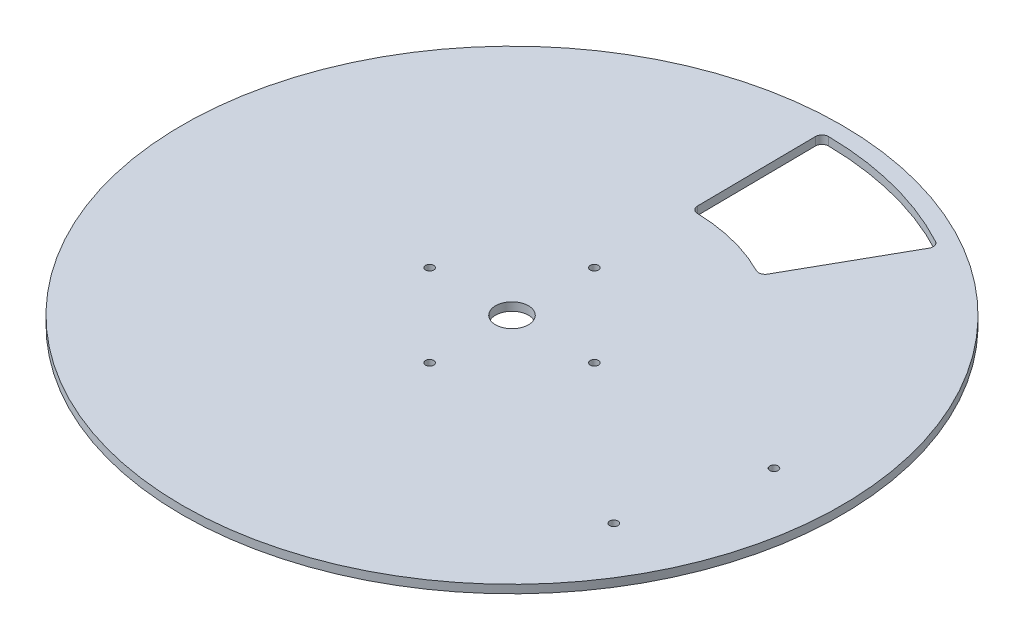
from build123d import *

# Parameters (mm, degrees)
SKETCH1_R           = 127
BOSS_EXTRUDE1_DEPTH = 3.175
SKETCH2_R           = 6.35
CUT_EXTRUDE1_DEPTH  = 180.63318353
CUT_EXTRUDE2_DEPTH  = 180.63318353
SKETCH4_R           = 1.5875
CUT_EXTRUDE3_DEPTH  = 180.63318353
CIRPATTERN1_COUNT   = 4
FILLET1_R           = 2.54
SKETCH5_R           = 1.5875
CUT_EXTRUDE4_DEPTH  = 180.63318353


with BuildPart() as part:
    # Sketch1 → Boss-Extrude1 (new body)
    with BuildSketch(Plane(origin=(0, 0, 0), x_dir=(1, 0, 0), z_dir=(0, 1, 0))):
        with Locations(Location((0, 0, 0), (0, 0, 270))):
            Circle(SKETCH1_R)
    extrude(amount=BOSS_EXTRUDE1_DEPTH)

    # Sketch2 → Cut-Extrude1 (cut, through all)
    with BuildSketch(Plane(origin=(0, 3.175, 0), x_dir=(1, 0, 0), z_dir=(0, 1, 0))):
        with Locations(Location((0, 0, 0), (0, 0, 270))):
            Circle(SKETCH2_R)
    extrude(amount=-CUT_EXTRUDE1_DEPTH, mode=Mode.SUBTRACT)

    # Sketch3 → Cut-Extrude2 (cut, through all)
    with BuildSketch(Plane(origin=(0, 3.175, 0), x_dir=(1, 0, 0), z_dir=(0, 1, 0))):
        with BuildLine():
            Line((-0.69608151, 69.707591228), (-1.204718825, 120.643985149))
            ThreePointArc((-1.204718825, 120.643985149), (30.046443244, 116.817986877), (59.221085226, 104.981025331))
            Line((59.221085226, 104.981025331), (34.319233166, 60.837593106))
            ThreePointArc((34.319233166, 60.837593106), (17.387075213, 67.544440681), (-0.69608151, 69.707591228))
        make_face()
    extrude(amount=-CUT_EXTRUDE2_DEPTH, mode=Mode.SUBTRACT)

    # Sketch4 → Cut-Extrude3 (cut, through all)
    with BuildSketch(Plane(origin=(0, 3.175, 0), x_dir=(1, 0, 0), z_dir=(0, 1, 0))):
        with Locations(Location((0, -31.75, 0), (0, 0, 270))):
            Circle(SKETCH4_R)
    cut_extrude3 = extrude(amount=-CUT_EXTRUDE3_DEPTH, mode=Mode.SUBTRACT)

    # CirPattern1: Cut-Extrude3 ×4 about axis
    cirpattern1_axis = Axis((0, 0, 0), (0, 1, 0))
    for i in range(1, CIRPATTERN1_COUNT):
        add(cut_extrude3.rotate(cirpattern1_axis, i * 360 / CIRPATTERN1_COUNT), mode=Mode.SUBTRACT)

    # Fillet1
    fillet1_edges = [part.edges().sort_by_distance(p)[0] for p in [
        (34.319233166, 1.5875, -60.837593106),
        (-0.69608151, 1.5875, -69.707591228),
        (-1.204718825, 1.5875, -120.643985149),
        (59.221085226, 1.5875, -104.981025331),
    ]]
    fillet(fillet1_edges, radius=FILLET1_R)

    # Sketch5 → Cut-Extrude4 (cut, through all)
    with BuildSketch(Plane.XZ):
        with Locations(Location((89.061954982, 49.824926956, 0), (0, 0, 270))):
            Circle(SKETCH5_R)
        with Locations(Location((101.542683253, 0.581943478, 0), (0, 0, 90))):
            Circle(SKETCH5_R)
    extrude(amount=-CUT_EXTRUDE4_DEPTH, mode=Mode.SUBTRACT)


solid = part.part
